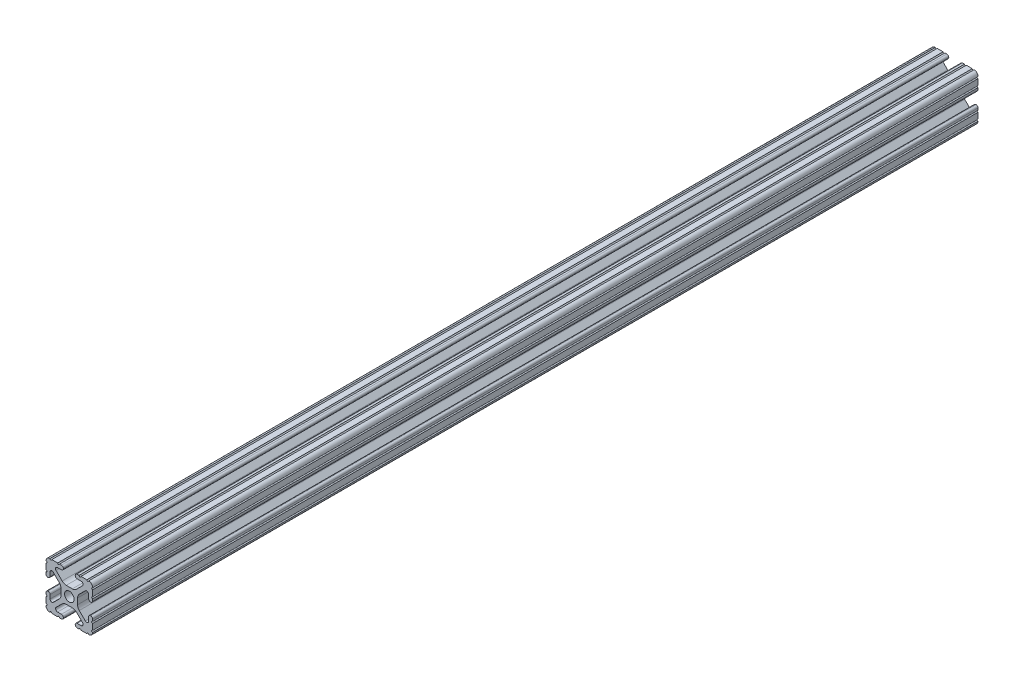
from build123d import *

# Parameters (mm, degrees)
SKETCH1_R      = 2.6035
EXTRUDE1_DEPTH = 482.6


with BuildPart() as part:
    # Sketch1 → Extrude1 (new body)
    with BuildSketch(Plane.XY):
        with BuildLine():
            Line((-7.207036008, 8.724370562), (-3.898272566, 5.423169045))
            ThreePointArc((-3.898272566, 5.423169045), (-2.869120213, 4.736787962), (-1.655778399, 4.4958))
            Line((-1.655778399, 4.4958), (1.655778399, 4.4958))
            ThreePointArc((1.655778399, 4.4958), (2.869120213, 4.736787962), (3.898272566, 5.423169045))
            Line((3.898272566, 5.423169045), (7.207036008, 8.724370562))
            ThreePointArc((7.207036008, 8.724370562), (7.432222385, 9.85140422), (6.476788598, 10.4902))
            Line((6.476788598, 10.4902), (4.287512407, 10.4902))
            ThreePointArc((4.287512407, 10.4902), (3.54574862, 10.79744862), (3.2385, 11.539212407))
            Line((3.2385, 11.539212407), (3.2385, 11.650987593))
            ThreePointArc((3.2385, 11.650987593), (3.54574862, 12.39275138), (4.287512407, 12.7))
            Line((4.287512407, 12.7), (5.317126718, 12.7))
            ThreePointArc((5.317126718, 12.7), (5.825126718, 12.192), (6.333126718, 12.7))
            Line((6.333126718, 12.7), (9.550443118, 12.7))
            ThreePointArc((9.550443118, 12.7), (10.058366869, 12.192000006), (10.566443095, 12.699847501))
            ThreePointArc((10.566443095, 12.699847501), (12.082537762, 12.08250727), (12.699846982, 10.566399977))
            ThreePointArc((12.699846982, 10.566399977), (12.192000006, 10.058323491), (12.7, 9.5504))
            Line((12.7, 9.5504), (12.7, 6.3330836))
            ThreePointArc((12.7, 6.3330836), (12.192, 5.8250836), (12.7, 5.3170836))
            Line((12.7, 5.3170836), (12.7, 4.287469289))
            ThreePointArc((12.7, 4.287469289), (12.39275138, 3.545705502), (11.650987593, 3.238456882))
            Line((11.650987593, 3.238456882), (11.539212407, 3.238456882))
            ThreePointArc((11.539212407, 3.238456882), (10.79744862, 3.545705502), (10.4902, 4.287469289))
            Line((10.4902, 4.287469289), (10.4902, 6.402089023))
            ThreePointArc((10.4902, 6.402089023), (9.856505071, 7.351067942), (8.737131347, 7.129408934))
            Line((8.737131347, 7.129408934), (5.441005833, 3.840816462))
            ThreePointArc((5.441005833, 3.840816462), (4.750877967, 2.809883091), (4.5085, 1.593185507))
            Line((4.5085, 1.593185507), (4.5085, -1.593185507))
            ThreePointArc((4.5085, -1.593185507), (4.750877967, -2.809883091), (5.441005833, -3.840816462))
            Line((5.441005833, -3.840816462), (8.737131347, -7.129408934))
            ThreePointArc((8.737131347, -7.129408934), (9.856505071, -7.351067942), (10.4902, -6.402089023))
            Line((10.4902, -6.402089023), (10.4902, -4.287469289))
            ThreePointArc((10.4902, -4.287469289), (10.79744862, -3.545705502), (11.539212407, -3.238456882))
            Line((11.539212407, -3.238456882), (11.650987593, -3.238456882))
            ThreePointArc((11.650987593, -3.238456882), (12.39275138, -3.545705502), (12.7, -4.287469289))
            Line((12.7, -4.287469289), (12.7, -5.3170836))
            ThreePointArc((12.7, -5.3170836), (12.192, -5.8250836), (12.7, -6.3330836))
            Line((12.7, -6.3330836), (12.7, -9.5504))
            ThreePointArc((12.7, -9.5504), (12.192000006, -10.058323491), (12.699846982, -10.566399977))
            ThreePointArc((12.699846982, -10.566399977), (12.082537762, -12.08250727), (10.566443095, -12.699847501))
            ThreePointArc((10.566443095, -12.699847501), (10.058366869, -12.192000006), (9.550443118, -12.7))
            Line((9.550443118, -12.7), (6.333126718, -12.7))
            ThreePointArc((6.333126718, -12.7), (5.825126718, -12.192), (5.317126718, -12.7))
            Line((5.317126718, -12.7), (4.287512407, -12.7))
            ThreePointArc((4.287512407, -12.7), (3.54574862, -12.39275138), (3.2385, -11.650987593))
            Line((3.2385, -11.650987593), (3.2385, -11.539212407))
            ThreePointArc((3.2385, -11.539212407), (3.54574862, -10.79744862), (4.287512407, -10.4902))
            Line((4.287512407, -10.4902), (6.416408329, -10.4902))
            ThreePointArc((6.416408329, -10.4902), (7.41473083, -9.822813117), (7.179650497, -8.645192506))
            Line((7.179650497, -8.645192506), (3.952270251, -5.423690499))
            ThreePointArc((3.952270251, -5.423690499), (2.922936451, -4.736929036), (1.709253557, -4.4958))
            Line((1.709253557, -4.4958), (-1.709253557, -4.4958))
            ThreePointArc((-1.709253557, -4.4958), (-2.922936451, -4.736929036), (-3.952270251, -5.423690499))
            Line((-3.952270251, -5.423690499), (-7.179650497, -8.645192506))
            ThreePointArc((-7.179650497, -8.645192506), (-7.41473083, -9.822813117), (-6.416408329, -10.4902))
            Line((-6.416408329, -10.4902), (-4.287512407, -10.4902))
            ThreePointArc((-4.287512407, -10.4902), (-3.54574862, -10.79744862), (-3.2385, -11.539212407))
            Line((-3.2385, -11.539212407), (-3.2385, -11.650987593))
            ThreePointArc((-3.2385, -11.650987593), (-3.54574862, -12.39275138), (-4.287512407, -12.7))
            Line((-4.287512407, -12.7), (-5.317126718, -12.7))
            ThreePointArc((-5.317126718, -12.7), (-5.825126718, -12.192), (-6.333126718, -12.7))
            Line((-6.333126718, -12.7), (-9.550443118, -12.7))
            ThreePointArc((-9.550443118, -12.7), (-10.058366869, -12.192000006), (-10.566443095, -12.699847501))
            ThreePointArc((-10.566443095, -12.699847501), (-12.082537762, -12.08250727), (-12.699846982, -10.566399977))
            ThreePointArc((-12.699846982, -10.566399977), (-12.192000006, -10.058323491), (-12.7, -9.5504))
            Line((-12.7, -9.5504), (-12.7, -6.3330836))
            ThreePointArc((-12.7, -6.3330836), (-12.192, -5.8250836), (-12.7, -5.3170836))
            Line((-12.7, -5.3170836), (-12.7, -4.287469289))
            ThreePointArc((-12.7, -4.287469289), (-12.39275138, -3.545705502), (-11.650987593, -3.238456882))
            Line((-11.650987593, -3.238456882), (-11.539212407, -3.238456882))
            ThreePointArc((-11.539212407, -3.238456882), (-10.79744862, -3.545705502), (-10.4902, -4.287469289))
            Line((-10.4902, -4.287469289), (-10.4902, -6.402089023))
            ThreePointArc((-10.4902, -6.402089023), (-9.856505071, -7.351067942), (-8.737131347, -7.129408934))
            Line((-8.737131347, -7.129408934), (-5.441005833, -3.840816462))
            ThreePointArc((-5.441005833, -3.840816462), (-4.750877967, -2.809883091), (-4.5085, -1.593185507))
            Line((-4.5085, -1.593185507), (-4.5085, 1.593185507))
            ThreePointArc((-4.5085, 1.593185507), (-4.750877967, 2.809883091), (-5.441005833, 3.840816462))
            Line((-5.441005833, 3.840816462), (-8.737131347, 7.129408934))
            ThreePointArc((-8.737131347, 7.129408934), (-9.856505071, 7.351067942), (-10.4902, 6.402089023))
            Line((-10.4902, 6.402089023), (-10.4902, 4.287469289))
            ThreePointArc((-10.4902, 4.287469289), (-10.79744862, 3.545705502), (-11.539212407, 3.238456882))
            Line((-11.539212407, 3.238456882), (-11.650987593, 3.238456882))
            ThreePointArc((-11.650987593, 3.238456882), (-12.39275138, 3.545705502), (-12.7, 4.287469289))
            Line((-12.7, 4.287469289), (-12.7, 5.3170836))
            ThreePointArc((-12.7, 5.3170836), (-12.192, 5.8250836), (-12.7, 6.3330836))
            Line((-12.7, 6.3330836), (-12.7, 9.5504))
            ThreePointArc((-12.7, 9.5504), (-12.192000006, 10.058323491), (-12.699846982, 10.566399977))
            ThreePointArc((-12.699846982, 10.566399977), (-12.082537762, 12.08250727), (-10.566443095, 12.699847501))
            ThreePointArc((-10.566443095, 12.699847501), (-10.058366869, 12.192000006), (-9.550443118, 12.7))
            Line((-9.550443118, 12.7), (-6.333126718, 12.7))
            ThreePointArc((-6.333126718, 12.7), (-5.825126718, 12.192), (-5.317126718, 12.7))
            Line((-5.317126718, 12.7), (-4.287512407, 12.7))
            ThreePointArc((-4.287512407, 12.7), (-3.54574862, 12.39275138), (-3.2385, 11.650987593))
            Line((-3.2385, 11.650987593), (-3.2385, 11.539212407))
            ThreePointArc((-3.2385, 11.539212407), (-3.54574862, 10.79744862), (-4.287512407, 10.4902))
            Line((-4.287512407, 10.4902), (-6.476788598, 10.4902))
            ThreePointArc((-6.476788598, 10.4902), (-7.432222385, 9.85140422), (-7.207036008, 8.724370562))
        make_face()
        Circle(SKETCH1_R, mode=Mode.SUBTRACT)
    extrude(amount=-EXTRUDE1_DEPTH)


solid = part.part
